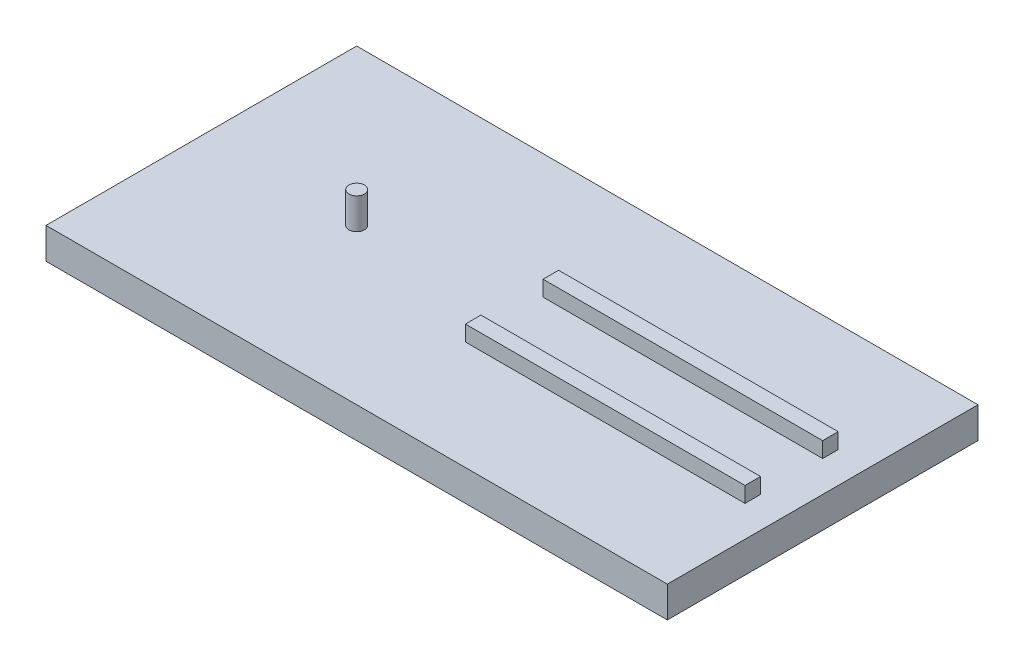
from build123d import *

# Parameters (mm, degrees)
SKETCH1_W           = 200
SKETCH1_H           = 100
BOSS_EXTRUDE1_DEPTH = 10
SKETCH2_W           = 90
SKETCH2_H           = 5
BOSS_EXTRUDE2_DEPTH = 5
SKETCH2_3_R         = 2.5
BOSS_EXTRUDE3_DEPTH = 10


with BuildPart() as part:
    # Sketch1 → Boss-Extrude1 (new body)
    with BuildSketch(Plane(origin=(0, 0, 0), x_dir=(1, 0, 0), z_dir=(0, 1, 0))):
        Rectangle(SKETCH1_W, SKETCH1_H)
    extrude(amount=BOSS_EXTRUDE1_DEPTH)

    # Sketch2 → Boss-Extrude2 (add)
    with BuildSketch(Plane(origin=(0, 10, 0), x_dir=(1, 0, 0), z_dir=(0, 1, 0))):
        with Locations((45, 12.5)):
            Rectangle(SKETCH2_W, SKETCH2_H)
        with Locations((45, -12.5)):
            Rectangle(SKETCH2_W, SKETCH2_H)
    extrude(amount=BOSS_EXTRUDE2_DEPTH)

    # Sketch2<3> → Boss-Extrude3 (add)
    with BuildSketch(Plane(origin=(0, 10, 0), x_dir=(1, 0, 0), z_dir=(0, 1, 0))):
        with Locations((-50, 0)):
            Circle(SKETCH2_3_R)
    extrude(amount=BOSS_EXTRUDE3_DEPTH)


solid = part.part
